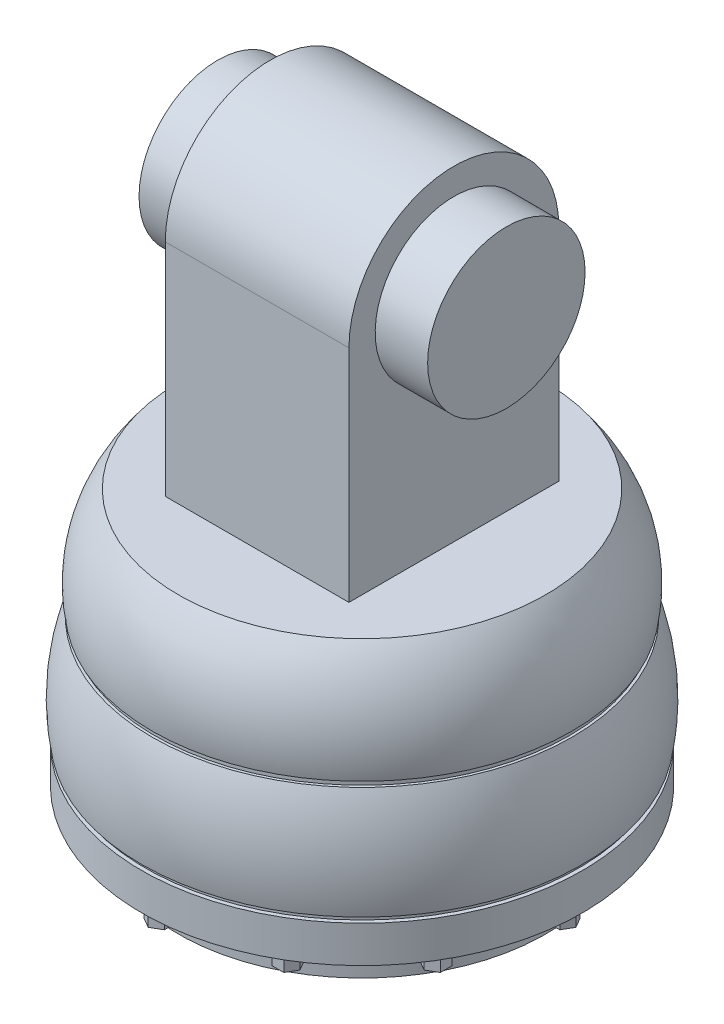
from build123d import *

# Parameters (mm, degrees)
SKETCH2_R            = 39.5
BOSS_EXTRUDE1_DEPTH  = 1
SKETCH4_R            = 41.25
BOSS_EXTRUDE2_DEPTH  = 1
SKETCH5_R            = 42
BOSS_EXTRUDE3_DEPTH  = 7
SKETCH6_R            = 35
BOSS_EXTRUDE4_DEPTH  = 7
BOSS_EXTRUDE5_DEPTH  = 3
CIRPATTERN1_COUNT    = 12
SKETCH8_R            = 15
BOSS_EXTRUDE6_DEPTH  = 10
SKETCH9_W            = 35
SKETCH9_H            = 40
BOSS_EXTRUDE7_DEPTH  = 42
BOSS_EXTRUDE8_DEPTH  = 35
SKETCH11_R           = 15
BOSS_EXTRUDE9_DEPTH  = 10
BOSS_EXTRUDE10_START = 10
SKETCH12_R           = 15
BOSS_EXTRUDE10_DEPTH = 10


with BuildPart() as part:
    # Sketch1 → Revolve1 (revolve)
    with BuildSketch(Plane.XY):
        with BuildLine():
            Line((-35, 0), (0, 0))
            Line((0, 0), (0, -20))
            Line((0, -20), (-40, -20))
            ThreePointArc((-40, -20), (-39.657515479, -9.46062113), (-35, 0))
        make_face()
    revolve(axis=Axis((0, 0, 0), (0, -1, 0)))

    # Sketch2 → Boss-Extrude1 (add)
    with BuildSketch(Plane.XZ.offset(20)):
        Circle(SKETCH2_R)
    extrude(amount=BOSS_EXTRUDE1_DEPTH)

    # Sketch3 → Revolve2 (revolve)
    with BuildSketch(Plane(origin=(0, 0, 0), x_dir=(0, 0, -1), z_dir=(1, 0, 0)), mode=Mode.PRIVATE) as revolve2_sk:
        with BuildLine():
            Line((0, -21), (-40, -21))
            ThreePointArc((-40, -21), (-42.384109041, -30.861589096), (-42, -41))
            Line((-42, -41), (0, -41))
            Line((0, -41), (0, -21))
        make_face()
    revolve(revolve2_sk.sketch.rotate(Axis((0, -21, 0), (0, -1, 0)), 90), axis=Axis((0, -21, 0), (0, -1, 0)))

    # Sketch4 → Boss-Extrude2 (add)
    with BuildSketch(Plane.XZ.offset(41)):
        with Locations(Location((0, 0, 0), (0, 0, 270))):
            Circle(SKETCH4_R)
    extrude(amount=BOSS_EXTRUDE2_DEPTH)

    # Sketch5 → Boss-Extrude3 (add)
    with BuildSketch(Plane.XZ.offset(42)):
        with Locations(Location((0, 0, 0), (0, 0, 270))):
            Circle(SKETCH5_R)
    extrude(amount=BOSS_EXTRUDE3_DEPTH)

    # Sketch6 → Boss-Extrude4 (add)
    with BuildSketch(Plane.XZ.offset(49)):
        with Locations(Location((0, 0, 0), (0, 0, 270))):
            Circle(SKETCH6_R)
    extrude(amount=BOSS_EXTRUDE4_DEPTH)

    # Sketch7 → Boss-Extrude5 (add)
    with BuildSketch(Plane.XZ.offset(49)):
        Polygon((40.75, 0), (39.625, 1.948557159), (37.375, 1.948557159), (36.25, 0), (37.375, -1.948557159), (39.625, -1.948557159), align=None)
        Polygon((39.047649731, 0.948557159), (37.952350269, 0.948557159), (37.404700538, 0), (37.952350269, -0.948557159), (39.047649731, -0.948557159), (39.595299462, 0), align=None, mode=Mode.SUBTRACT)
    boss_extrude5 = extrude(amount=BOSS_EXTRUDE5_DEPTH)

    # CirPattern1: Boss-Extrude5 ×12 about axis
    cirpattern1_axis = Axis((0, 0, 0), (0, 1, 0))
    for i in range(1, CIRPATTERN1_COUNT):
        add(boss_extrude5.rotate(cirpattern1_axis, i * 360 / CIRPATTERN1_COUNT))

    # Sketch8 → Boss-Extrude6 (add)
    with BuildSketch(Plane.XZ.offset(56)):
        with Locations(Location((0, 0, 0), (0, 0, 270))):
            Circle(SKETCH8_R)
    extrude(amount=BOSS_EXTRUDE6_DEPTH)

    # Sketch9 → Boss-Extrude7 (add)
    with BuildSketch(Plane(origin=(0, 0, 0), x_dir=(1, 0, 0), z_dir=(0, 1, 0))):
        Rectangle(SKETCH9_W, SKETCH9_H)
    extrude(amount=BOSS_EXTRUDE7_DEPTH)

    # Sketch10 → Boss-Extrude8 (add)
    with BuildSketch(Plane(origin=(17.5, 0, 0), x_dir=(0, 0, -1), z_dir=(1, 0, 0))):
        with BuildLine():
            Line((-20, 42), (20, 42))
            ThreePointArc((20, 42), (0, 62), (-20, 42))
        make_face()
    extrude(amount=-BOSS_EXTRUDE8_DEPTH)

    # Sketch11 → Boss-Extrude9 (add)
    with BuildSketch(Plane(origin=(17.5, 0, 0), x_dir=(0, 0, -1), z_dir=(1, 0, 0))):
        with Locations(Location((0, 42, 0), (0, 0, 270))):
            Circle(SKETCH11_R)
    extrude(amount=BOSS_EXTRUDE9_DEPTH)

    # Sketch12 → Boss-Extrude10 (add)
    with BuildSketch(Plane.ZY.offset(17.5).offset(BOSS_EXTRUDE10_START)):
        with Locations(Location((0, 42, 0), (0, 0, 270))):
            Circle(SKETCH12_R)
    extrude(amount=-BOSS_EXTRUDE10_DEPTH)


solid = part.part
